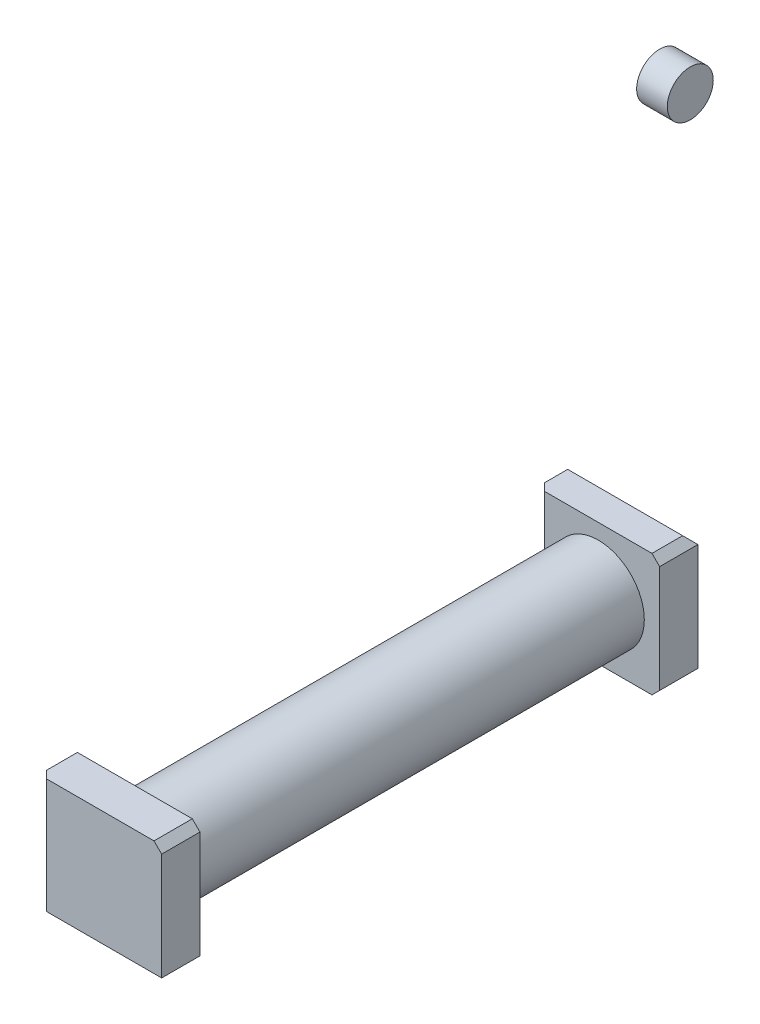
from build123d import *

# Parameters (mm, degrees)
SKETCH1_R           = 30
BOSS_EXTRUDE1_DEPTH = 300
SKETCH2_W           = 80
SKETCH2_H           = 80
BOSS_EXTRUDE2_DEPTH = 25
SKETCH3_R           = 21
CUT_EXTRUDE1_DEPTH  = 30
SKETCH4_W           = 80
SKETCH4_H           = 80
BOSS_EXTRUDE3_DEPTH = 25
SKETCH5_R           = 15
BOSS_EXTRUDE4_DEPTH = 20
CHAMFER1_SIZE       = 5
CHAMFER3_SIZE       = 5


with BuildPart() as part:
    # Sketch1 → Boss-Extrude1 (new body)
    with BuildSketch(Plane.XY):
        Circle(SKETCH1_R)
    extrude(amount=BOSS_EXTRUDE1_DEPTH)

    # Sketch2 → Boss-Extrude2 (add)
    with BuildSketch(Plane.XY):
        Rectangle(SKETCH2_W, SKETCH2_H)
    extrude(amount=-BOSS_EXTRUDE2_DEPTH)

    # Sketch3 → Cut-Extrude1 (cut)
    with BuildSketch(Plane.XY):
        Circle(SKETCH3_R)
    extrude(amount=-CUT_EXTRUDE1_DEPTH, mode=Mode.SUBTRACT)

    # Sketch4 → Boss-Extrude3 (add)
    with BuildSketch(Plane.XY.offset(300)):
        Rectangle(SKETCH4_W, SKETCH4_H)
    extrude(amount=BOSS_EXTRUDE3_DEPTH)

    # Chamfer1
    chamfer1_edges = [part.edges().sort_by_distance(p)[0] for p in [
        (40, -40, -12.5),
        (-40, 0, 0),
        (0, 40, -25),
        (40, 40, -12.5),
    ]]
    chamfer(chamfer1_edges, length=CHAMFER1_SIZE)

    # Chamfer3
    chamfer3_edges = [part.edges().sort_by_distance(p)[0] for p in [
        (40, -40, 312.5),
        (0, -40, 325),
        (-40, 0, 325),
        (40, 40, 312.5),
    ]]
    chamfer(chamfer3_edges, length=CHAMFER3_SIZE)


with BuildPart() as body_2:
    # Sketch5 → Boss-Extrude4 (new body)
    with BuildSketch(Plane(origin=(40, 0, 0), x_dir=(0, 0, -1), z_dir=(1, 0, 0))):
        with Locations((0, 312.5)):
            Circle(SKETCH5_R)
    extrude(amount=BOSS_EXTRUDE4_DEPTH)


solid = Compound([part.part, body_2.part])
